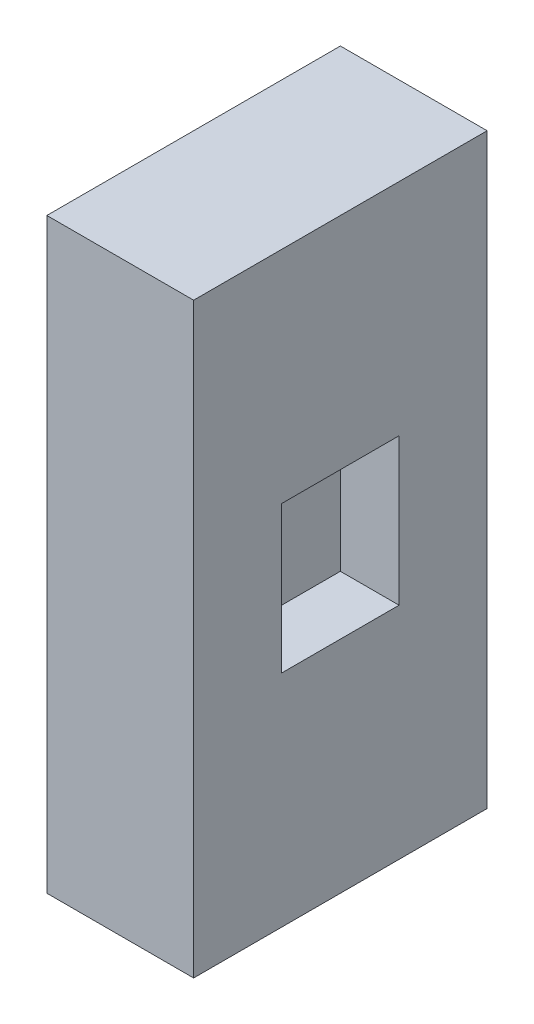
from build123d import *

# Parameters (mm, degrees)
RECTANGLESKETCH_W = 20
RECTANGLESKETCH_H = 40
BLINDBOSS_DEPTH   = 10
CUTSKETCH_W       = 8
CUTSKETCH_H       = 10
BLINDCUT_DEPTH    = 4


with BuildPart() as part:
    # RectangleSketch → BlindBoss (new body)
    with BuildSketch(Plane(origin=(0, 0, 0), x_dir=(0, 0, -1), z_dir=(1, 0, 0))):
        with Locations((-10, 20)):
            Rectangle(RECTANGLESKETCH_W, RECTANGLESKETCH_H)
    extrude(amount=BLINDBOSS_DEPTH)

    # CutSketch → BlindCut (cut)
    with BuildSketch(Plane(origin=(10, 0, 0), x_dir=(0, 0, -1), z_dir=(1, 0, 0))):
        with Locations((-10, 20)):
            Rectangle(CUTSKETCH_W, CUTSKETCH_H)
    extrude(amount=-BLINDCUT_DEPTH, mode=Mode.SUBTRACT)


solid = part.part
